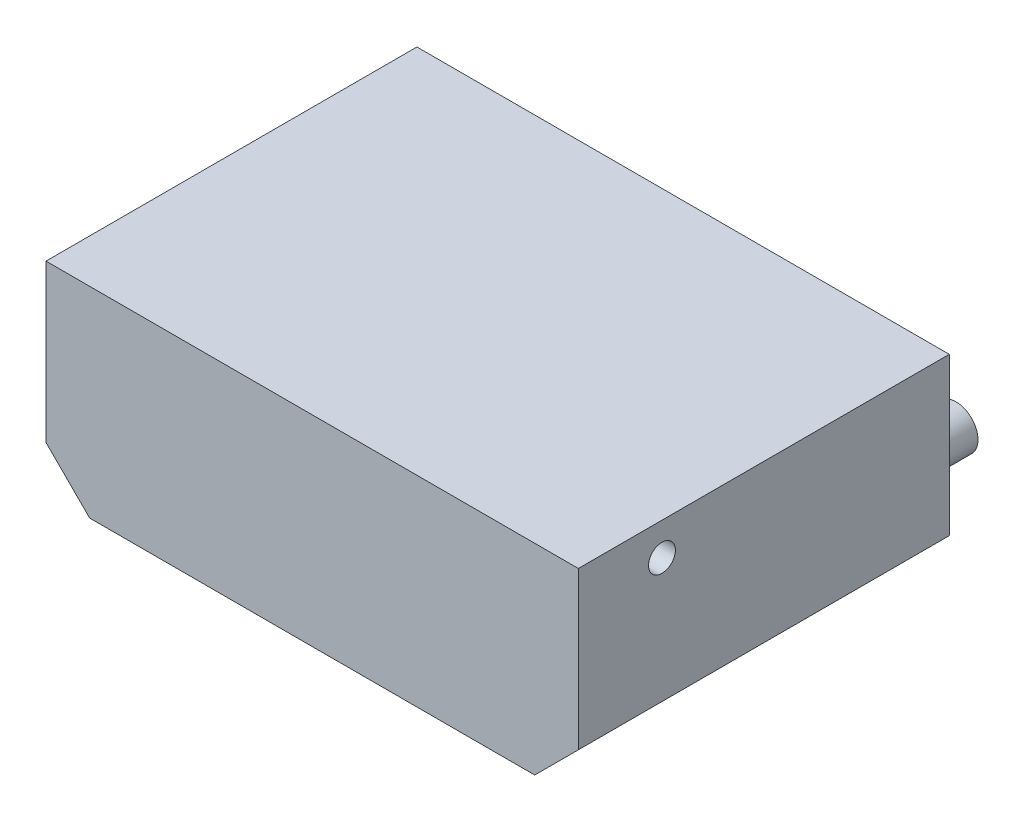
from build123d import *

# Parameters (mm, degrees)
BOSS_EXTRUDE1_DEPTH = 170
SKETCH2_W           = 174
SKETCH2_H           = 140
CUT_EXTRUDE1_DEPTH  = 0.1
SKETCH3_R           = 10
BOSS_EXTRUDE2_DEPTH = 18.7
CUT_EXTRUDE2_DEPTH  = 0.1
CUT_EXTRUDE3_REACH  = 302.919
SKETCH5_R           = 6.160372281


with BuildPart() as part:
    # Sketch1 → Boss-Extrude1 (new body)
    with BuildSketch(Plane.XY):
        Polygon((-102, -46), (-122, -26), (-122, 46), (122, 46), (122, -26), (102, -46), align=None)
    extrude(amount=BOSS_EXTRUDE1_DEPTH)

    # Sketch2 → Cut-Extrude1 (cut)
    with BuildSketch(Plane.XZ.offset(46)):
        with Locations((0, 85)):
            Rectangle(SKETCH2_W, SKETCH2_H)
    extrude(amount=-CUT_EXTRUDE1_DEPTH, mode=Mode.SUBTRACT)

    # Sketch3 → Boss-Extrude2 (add)
    with BuildSketch(Plane(origin=(0, 0, 0), x_dir=(-1, 0, 0), z_dir=(0, 0, -1))):
        with Locations(Location((-76.475491295, 0, 0), (0, 0, 180))):
            Circle(SKETCH3_R)
        with Locations(Location((-106.475491295, 0, 0), (0, 0, 180))):
            Circle(SKETCH3_R)
        with Locations(Location((-16.413091666, 0, 0), (0, 0, 180))):
            Circle(SKETCH3_R)
        with Locations(Location((13.586908334, 0, 0), (0, 0, 180))):
            Circle(SKETCH3_R)
    extrude(amount=BOSS_EXTRUDE2_DEPTH)

    # Sketch4 → Cut-Extrude2 (cut)
    # profile 1 of 8: a face of its own
    with BuildSketch(Plane.XZ.offset(45.9)):
        with BuildLine():
            Line((-42.268322494, 131.561403862), (-42.268322494, 131.083569118))
            add(Edge.make_bspline(
                [(-42.268322494, 131.083569118), (-42.422310774, 131.050224304), (-42.731367697, 130.983300734), (-43.16425574, 130.761058835), (-43.574269447, 130.460579751), (-43.808169871, 130.202231607), (-43.929544846, 130.068170287)],
                knots=[0, 0, 0, 0, 0.947408205, 1.901463304, 2.911033016, 4, 4, 4, 4], degree=3))
            add(Edge.make_bspline(
                [(-43.929544846, 130.068170287), (-43.977852767, 130.0066807), (-44.085689478, 129.869418846), (-44.238600073, 129.62465817), (-44.411442585, 129.328958663), (-44.596616217, 128.976318721), (-44.800647362, 128.569989633), (-45.025747476, 128.112451902), (-45.259781717, 127.5979898), (-45.420542284, 127.237357907), (-45.504906267, 127.048105382)],
                knots=[0, 0, 0, 0, 0.549484672, 1.226602557, 2.02645952, 2.958032851, 4.026270025, 5.223684279, 6.543044117, 8, 8, 8, 8], degree=3))
            Line((-45.504906267, 127.048105382), (-51.182926935, 114.120435709))
            Line((-51.182926935, 114.120435709), (-51.836216624, 114.120435709))
            Line((-51.836216624, 114.120435709), (-57.738222328, 127.746192078))
            add(Edge.make_bspline(
                [(-57.738222328, 127.746192078), (-57.822436758, 127.935515149), (-57.981782084, 128.29374053), (-58.213763464, 128.798753775), (-58.423274679, 129.242766517), (-58.606248109, 129.627353725), (-58.776129059, 129.945709462), (-58.920816078, 130.204004053), (-59.041781442, 130.402318114), (-59.176862593, 130.590301499), (-59.382327642, 130.761611506), (-59.687730804, 130.916067519), (-60.072261074, 131.022647616), (-60.355754594, 131.06226788), (-60.508170609, 131.083569118)],
                knots=[0, 0, 0, 0, 1.610291577, 3.046893938, 4.318728555, 5.425938633, 6.356009659, 7.122477988, 7.726240531, 8.161409343, 8.91557796, 9.776299492, 10.804460958, 12, 12, 12, 12], degree=3))
            Line((-60.508170609, 131.083569118), (-60.508170609, 131.561403862))
            Line((-60.508170609, 131.561403862), (-52.444709306, 131.561403862))
            Line((-52.444709306, 131.561403862), (-52.444709306, 131.083569118))
            Line((-52.444709306, 131.083569118), (-52.720957517, 131.083569118))
            add(Edge.make_bspline(
                [(-52.720957517, 131.083569118), (-52.891587215, 131.079806061), (-53.203789309, 131.072920774), (-53.628631285, 131.029736009), (-53.969575075, 130.947249337), (-54.152014222, 130.850286848), (-54.232856511, 130.807320907)],
                knots=[0, 0, 0, 0, 1.317031691, 2.409780111, 3.29534303, 4, 4, 4, 4], degree=3))
            add(Edge.make_bspline(
                [(-54.232856511, 130.807320907), (-54.277473498, 130.774801438), (-54.364247837, 130.711555228), (-54.454372234, 130.578245563), (-54.515609876, 130.42667613), (-54.521134191, 130.316468497), (-54.524037058, 130.258557568)],
                knots=[0, 0, 0, 0, 1.014177409, 1.972445466, 2.934578636, 4, 4, 4, 4], degree=3))
            add(Edge.make_bspline(
                [(-54.524037058, 130.258557568), (-54.51759972, 130.177346048), (-54.503328868, 129.997309277), (-54.446781809, 129.789988908), (-54.384882385, 129.622629018), (-54.337993199, 129.492058361), (-54.268189771, 129.329819645), (-54.192197776, 129.129992884), (-54.093307638, 128.898007031), (-53.977200191, 128.631704585), (-53.851295731, 128.326585327), (-53.759084016, 128.113138578), (-53.71022476, 128.000041786)],
                knots=[0, 0, 0, 0, 1.012231494, 2.244002945, 2.655403561, 3.233491586, 3.969557668, 4.852239662, 5.893194298, 7.106928332, 8.467078429, 10, 10, 10, 10], degree=3))
            Line((-53.71022476, 128.000041786), (-50.063001754, 119.589403676))
            Line((-50.063001754, 119.589403676), (-46.796553309, 127.021973795))
            add(Edge.make_bspline(
                [(-46.796553309, 127.021973795), (-46.743992783, 127.141303943), (-46.644010382, 127.368297763), (-46.505697534, 127.694785437), (-46.382886267, 127.988623442), (-46.27524101, 128.250174688), (-46.179403449, 128.477683514), (-46.106823388, 128.675577005), (-46.044908159, 128.838723117), (-45.97140133, 129.078848775), (-45.887522105, 129.382176018), (-45.870792644, 129.649509958), (-45.863282325, 129.769523572)],
                knots=[0, 0, 0, 0, 1.34070385, 2.550331934, 3.645759521, 4.615209621, 5.458693035, 6.183490299, 6.782524973, 7.251937004, 8.766318359, 10, 10, 10, 10], degree=3))
            add(Edge.make_bspline(
                [(-45.863282325, 129.769523572), (-45.865045448, 129.830699261), (-45.868499243, 129.950536727), (-45.907195817, 130.124551074), (-45.971097743, 130.287292593), (-46.061397271, 130.436868186), (-46.174919674, 130.572515024), (-46.31059618, 130.694054574), (-46.472716793, 130.795142895), (-46.592909722, 130.845101569), (-46.654696119, 130.870783334)],
                knots=[0, 0, 0, 0, 1.010725678, 1.979917312, 2.931899074, 3.892303657, 4.857111769, 5.848785412, 6.89414627, 8, 8, 8, 8], degree=3))
            add(Edge.make_bspline(
                [(-46.654696119, 130.870783334), (-46.751106707, 130.904210728), (-46.95670438, 130.975495372), (-47.296999425, 131.038418624), (-47.680496693, 131.074219371), (-47.949983983, 131.08034337), (-48.091933435, 131.083569118)],
                knots=[0, 0, 0, 0, 0.837444138, 1.785867817, 2.833730339, 4, 4, 4, 4], degree=3))
            Line((-48.091933435, 131.083569118), (-48.091933435, 131.561403862))
            Line((-48.091933435, 131.561403862), (-42.268322494, 131.561403862))
        make_face()
    # profile 2 of 8: a face of its own
    with BuildSketch(Plane.XZ.offset(45.9)):
        with BuildLine():
            Line((-32.715360699, 114.837187825), (-32.715360699, 114.359353081))
            Line((-32.715360699, 114.359353081), (-41.555303462, 114.359353081))
            Line((-41.555303462, 114.359353081), (-41.555303462, 114.837187825))
            Line((-41.555303462, 114.837187825), (-40.991607787, 114.837187825))
            add(Edge.make_bspline(
                [(-40.991607787, 114.837187825), (-40.874419273, 114.839376862), (-40.651358234, 114.843543557), (-40.334356413, 114.893064195), (-40.0513912, 114.97148981), (-39.884345139, 115.054896982), (-39.804487095, 115.094770616)],
                knots=[0, 0, 0, 0, 1.144467932, 2.17842344, 3.129177061, 4, 4, 4, 4], degree=3))
            add(Edge.make_bspline(
                [(-39.804487095, 115.094770616), (-39.752023379, 115.126419397), (-39.645901358, 115.190437596), (-39.50960772, 115.326045516), (-39.394109329, 115.491349899), (-39.334814502, 115.616409079), (-39.304253848, 115.680864794)],
                knots=[0, 0, 0, 0, 0.93343552, 1.888125192, 2.911536119, 4, 4, 4, 4], degree=3))
            add(Edge.make_bspline(
                [(-39.304253848, 115.680864794), (-39.292060648, 115.710433858), (-39.26428503, 115.777790994), (-39.243633861, 115.898582112), (-39.21368924, 116.045614439), (-39.198578397, 116.224528994), (-39.183334701, 116.43350563), (-39.171452541, 116.671255716), (-39.17020643, 116.938922919), (-39.167541573, 117.126816344), (-39.166129742, 117.226361544)],
                knots=[0, 0, 0, 0, 0.491154816, 1.118830903, 1.878082211, 2.802823963, 3.878617243, 5.106317376, 6.466938293, 8, 8, 8, 8], degree=3))
            Line((-39.166129742, 117.226361544), (-39.166129742, 128.694395398))
            add(Edge.make_bspline(
                [(-39.166129742, 128.694395398), (-39.167558231, 128.795184295), (-39.170291778, 128.988053327), (-39.171300965, 129.261950421), (-39.183430993, 129.505896596), (-39.198356347, 129.718670999), (-39.21464804, 129.903551704), (-39.242710616, 130.057222647), (-39.26499844, 130.183665593), (-39.311975145, 130.310280089), (-39.386792175, 130.448643644), (-39.513579615, 130.594480937), (-39.672755873, 130.729205177), (-39.864633066, 130.853435273), (-40.093485611, 130.959008057), (-40.36086046, 131.031082097), (-40.664034224, 131.076546195), (-40.878185904, 131.081137441), (-40.991607787, 131.083569118)],
                knots=[0, 0, 0, 0, 1.353963977, 2.590937397, 3.678525439, 4.633585292, 5.456840327, 6.168525469, 6.732370981, 7.176481794, 7.976852204, 8.830756602, 9.755347706, 10.770665926, 11.892520065, 13.125421506, 14.477527201, 16, 16, 16, 16], degree=3))
            Line((-40.991607787, 131.083569118), (-41.555303462, 131.083569118))
            Line((-41.555303462, 131.083569118), (-41.555303462, 131.561403862))
            Line((-41.555303462, 131.561403862), (-32.715360699, 131.561403862))
            Line((-32.715360699, 131.561403862), (-32.715360699, 131.083569118))
            Line((-32.715360699, 131.083569118), (-33.27532329, 131.083569118))
            add(Edge.make_bspline(
                [(-33.27532329, 131.083569118), (-33.392498481, 131.081334313), (-33.615534161, 131.077080502), (-33.931525083, 131.028331721), (-34.212805685, 130.948478265), (-34.378829809, 130.865777225), (-34.458710898, 130.825986326)],
                knots=[0, 0, 0, 0, 1.147815573, 2.184795468, 3.126629849, 4, 4, 4, 4], degree=3))
            add(Edge.make_bspline(
                [(-34.458710898, 130.825986326), (-34.511225686, 130.794376943), (-34.617451015, 130.730438437), (-34.753452299, 130.59368981), (-34.8729542, 130.429823584), (-34.934652862, 130.304433011), (-34.966410313, 130.239892148)],
                knots=[0, 0, 0, 0, 0.928829741, 1.878808762, 2.908183361, 4, 4, 4, 4], degree=3))
            add(Edge.make_bspline(
                [(-34.966410313, 130.239892148), (-34.978547501, 130.210312107), (-35.005733289, 130.144056504), (-35.028045639, 130.023624211), (-35.056402757, 129.876277657), (-35.072253665, 129.696258094), (-35.087141747, 129.488478888), (-35.099390735, 129.250755105), (-35.100386501, 128.983075694), (-35.10310411, 128.793939762), (-35.104534419, 128.694395398)],
                knots=[0, 0, 0, 0, 0.491143652, 1.100100526, 1.878201893, 2.802922625, 3.87869145, 5.087223688, 6.466973141, 8, 8, 8, 8], degree=3))
            Line((-35.104534419, 128.694395398), (-35.104534419, 117.226361544))
            add(Edge.make_bspline(
                [(-35.104534419, 117.226361544), (-35.103152709, 117.12556956), (-35.100508677, 116.932694619), (-35.09889698, 116.658837298), (-35.088670491, 116.414667302), (-35.067759125, 116.200949644), (-35.051125297, 116.016410063), (-35.029613026, 115.860206375), (-35.001284565, 115.735089338), (-34.956396916, 115.606611276), (-34.874104949, 115.472829235), (-34.75021689, 115.325953519), (-34.590258874, 115.191650501), (-34.39862173, 115.067291061), (-34.169694894, 114.961758317), (-33.902342641, 114.889672056), (-33.600395818, 114.844395966), (-33.387496682, 114.839675152), (-33.27532329, 114.837187825)],
                knots=[0, 0, 0, 0, 1.354319329, 2.591617395, 3.679490877, 4.636117144, 5.476222309, 6.168990776, 6.752950479, 7.19717785, 7.991448918, 8.845577426, 9.770411191, 10.785995884, 11.908144457, 13.141369476, 14.493830035, 16, 16, 16, 16], degree=3))
            Line((-33.27532329, 114.837187825), (-32.715360699, 114.837187825))
        make_face()
    # profile 3 of 8: a face of its own
    with BuildSketch(Plane.XZ.offset(45.9)):
        with BuildLine():
            Line((-31.759691211, 114.359353081), (-31.759691211, 114.837187825))
            Line((-31.759691211, 114.837187825), (-31.195995537, 114.837187825))
            add(Edge.make_bspline(
                [(-31.195995537, 114.837187825), (-31.080151575, 114.840045293), (-30.86257918, 114.845412047), (-30.556513148, 114.884747177), (-30.292527296, 114.954746527), (-30.066789049, 115.052566443), (-29.87652939, 115.177283927), (-29.719286986, 115.326905307), (-29.579649252, 115.490085591), (-29.514975778, 115.617102783), (-29.48251001, 115.680864794)],
                knots=[0, 0, 0, 0, 1.370884423, 2.574727263, 3.642922677, 4.592448042, 5.474721649, 6.318802883, 7.15604725, 8, 8, 8, 8], degree=3))
            add(Edge.make_bspline(
                [(-29.48251001, 115.680864794), (-29.47319392, 115.708074637), (-29.451532351, 115.771342371), (-29.431020412, 115.885618797), (-29.414235585, 116.030371421), (-29.393326406, 116.206766102), (-29.384466444, 116.416224816), (-29.378081699, 116.657675891), (-29.36825091, 116.931385686), (-29.369733364, 117.124314181), (-29.370517492, 117.226361544)],
                knots=[0, 0, 0, 0, 0.443546268, 1.031324162, 1.786729535, 2.694794477, 3.772216006, 5.021594906, 6.424606037, 8, 8, 8, 8], degree=3))
            Line((-29.370517492, 117.226361544), (-29.370517492, 128.694395398))
            add(Edge.make_bspline(
                [(-29.370517492, 128.694395398), (-29.37194598, 128.795184295), (-29.374679527, 128.988053327), (-29.375688715, 129.261950421), (-29.387818743, 129.505896596), (-29.402744097, 129.718670999), (-29.41903579, 129.903551704), (-29.447098366, 130.057222647), (-29.469386189, 130.183665593), (-29.516362895, 130.310280089), (-29.591179925, 130.448643644), (-29.717967364, 130.594480937), (-29.877143623, 130.729205177), (-30.069020815, 130.853435273), (-30.29787336, 130.959008057), (-30.565248209, 131.031082097), (-30.868421974, 131.076546195), (-31.082573653, 131.081137441), (-31.195995537, 131.083569118)],
                knots=[0, 0, 0, 0, 1.353963977, 2.590937397, 3.678525439, 4.633585292, 5.456840327, 6.168525469, 6.732370981, 7.176481794, 7.976852204, 8.830756602, 9.755347706, 10.770665926, 11.892520065, 13.125421506, 14.477527201, 16, 16, 16, 16], degree=3))
            Line((-31.195995537, 131.083569118), (-31.759691211, 131.083569118))
            Line((-31.759691211, 131.083569118), (-31.759691211, 131.561403862))
            Line((-31.759691211, 131.561403862), (-24.114335308, 131.561403862))
            add(Edge.make_bspline(
                [(-24.114335308, 131.561403862), (-23.865383885, 131.560124262), (-23.379559232, 131.557627144), (-22.67126664, 131.513037034), (-21.999250415, 131.453627421), (-21.365905459, 131.357617368), (-20.766306562, 131.246162335), (-20.206864378, 131.097375322), (-19.680210508, 130.934664691), (-19.351124788, 130.793929074), (-19.190397596, 130.72519306)],
                knots=[0, 0, 0, 0, 1.187623187, 2.317627336, 3.38521285, 4.405435058, 5.373093369, 6.293321195, 7.166449119, 8, 8, 8, 8], degree=3))
            add(Edge.make_bspline(
                [(-19.190397596, 130.72519306), (-19.004595225, 130.637486942), (-18.636513693, 130.463737802), (-18.119266561, 130.151400669), (-17.635501419, 129.810516103), (-17.183386127, 129.44028044), (-16.77024909, 129.031742645), (-16.387126388, 128.593512721), (-16.038483432, 128.122475013), (-15.730597701, 127.616933513), (-15.455019575, 127.089269228), (-15.217155889, 126.541988624), (-15.007319995, 125.980458122), (-14.847491788, 125.397153452), (-14.713158424, 124.799899151), (-14.627046854, 124.184267066), (-14.567646553, 123.55261676), (-14.561004194, 123.124777728), (-14.55764043, 122.908115296)],
                knots=[0, 0, 0, 0, 1.023059056, 2.026718722, 3.005407045, 3.969834614, 4.934282109, 5.896555333, 6.867417257, 7.849868272, 8.842554442, 9.830817097, 10.821274577, 11.826120625, 12.841487115, 13.869025607, 14.920850928, 16, 16, 16, 16], degree=3))
            add(Edge.make_bspline(
                [(-14.55764043, 122.908115296), (-14.564820927, 122.611608679), (-14.578959429, 122.027782845), (-14.690332455, 121.170883879), (-14.867186533, 120.347571096), (-15.122747714, 119.568686484), (-15.42829111, 118.839557875), (-15.787161272, 118.174599664), (-16.178919724, 117.569557077), (-16.624354129, 117.036311082), (-17.108018404, 116.564515165), (-17.618565384, 116.134474991), (-18.172130885, 115.762678566), (-18.759917593, 115.427420576), (-19.404309473, 115.143944025), (-20.10770071, 114.893658104), (-20.879734997, 114.682383422), (-21.419612803, 114.570378423), (-21.699030001, 114.512409522)],
                knots=[0, 0, 0, 0, 1.173207418, 2.310062444, 3.414262259, 4.501404309, 5.549709881, 6.539078478, 7.4884477, 8.39776528, 9.28236543, 10.160152656, 11.035781795, 11.917910606, 12.835037278, 13.817998386, 14.87069116, 16, 16, 16, 16], degree=3))
            add(Edge.make_bspline(
                [(-21.699030001, 114.512409522), (-21.844373357, 114.488127653), (-22.170908545, 114.433574867), (-22.721164441, 114.39020011), (-23.38117402, 114.366651718), (-23.85796762, 114.361905227), (-24.114335308, 114.359353081)],
                knots=[0, 0, 0, 0, 0.729469202, 1.638859668, 2.730435796, 4, 4, 4, 4], degree=3))
            Line((-24.114335308, 114.359353081), (-31.759691211, 114.359353081))
        make_face()
        with BuildLine():
            Line((-25.308922168, 130.605734374), (-25.308922168, 117.181564537))
            add(Edge.make_bspline(
                [(-25.308922168, 117.181564537), (-25.307605699, 117.021014182), (-25.305247175, 116.733379877), (-25.287206724, 116.353474614), (-25.26342519, 116.075531274), (-25.211529802, 115.844318532), (-25.079220237, 115.647408355), (-24.936921745, 115.553222475), (-24.86468518, 115.505409849)],
                knots=[0, 0, 0, 0, 1.581619866, 2.833554187, 3.746016832, 4.328809972, 5.15163522, 6, 6, 6, 6], degree=3))
            add(Edge.make_bspline(
                [(-24.86468518, 115.505409849), (-24.801998647, 115.475891329), (-24.667045353, 115.412343047), (-24.433912422, 115.358342607), (-24.165483299, 115.318810082), (-23.973917754, 115.316340508), (-23.871684853, 115.315022569)],
                knots=[0, 0, 0, 0, 0.812832084, 1.749887298, 2.799180973, 4, 4, 4, 4], degree=3))
            add(Edge.make_bspline(
                [(-23.871684853, 115.315022569), (-23.699764155, 115.319206319), (-23.364498403, 115.32736513), (-22.875891499, 115.394285076), (-22.420047206, 115.511356394), (-21.992844994, 115.665749894), (-21.60285145, 115.875174113), (-21.23991064, 116.122583457), (-20.908463916, 116.418005486), (-20.719349649, 116.647587066), (-20.623901827, 116.763459136)],
                knots=[0, 0, 0, 0, 1.117658457, 2.179566554, 3.198078308, 4.173511569, 5.125438597, 6.068069882, 7.024935961, 8, 8, 8, 8], degree=3))
            add(Edge.make_bspline(
                [(-20.623901827, 116.763459136), (-20.500027729, 116.934869725), (-20.245915298, 117.286497403), (-19.9396462, 117.88395974), (-19.679314856, 118.544875642), (-19.461974004, 119.271248082), (-19.301603461, 120.066463439), (-19.184042871, 120.926775562), (-19.106726207, 121.853983084), (-19.100360213, 122.494824014), (-19.097070497, 122.82598745)],
                knots=[0, 0, 0, 0, 0.797088956, 1.635129663, 2.524519068, 3.475303084, 4.491981832, 5.582369658, 6.750656001, 8, 8, 8, 8], degree=3))
            add(Edge.make_bspline(
                [(-19.097070497, 122.82598745), (-19.099501453, 123.094848376), (-19.104243803, 123.619346963), (-19.153725347, 124.385510737), (-19.234120376, 125.110930577), (-19.350720649, 125.794731112), (-19.493281556, 126.43790738), (-19.674590069, 127.038493572), (-19.882483799, 127.600117323), (-20.057109052, 127.949154628), (-20.142334, 128.119500472)],
                knots=[0, 0, 0, 0, 1.184457476, 2.310660313, 3.381113584, 4.398734162, 5.365689401, 6.281539716, 7.161314381, 8, 8, 8, 8], degree=3))
            add(Edge.make_bspline(
                [(-20.142334, 128.119500472), (-20.211872174, 128.243482252), (-20.348604395, 128.487266392), (-20.573096368, 128.831834391), (-20.824351786, 129.137299489), (-21.078814106, 129.420451703), (-21.355512701, 129.666817902), (-21.640085726, 129.889700125), (-21.946732047, 130.073362265), (-22.159829769, 130.174401968), (-22.26645876, 130.224959813)],
                knots=[0, 0, 0, 0, 1.119018596, 2.200315138, 3.231417848, 4.229706666, 5.193717379, 6.14394327, 7.071273713, 8, 8, 8, 8], degree=3))
            add(Edge.make_bspline(
                [(-22.26645876, 130.224959813), (-22.3492939, 130.257665654), (-22.5234614, 130.3264323), (-22.811869899, 130.402139849), (-23.135592406, 130.469785869), (-23.498757719, 130.519820775), (-23.898448113, 130.560482041), (-24.335408952, 130.590750873), (-24.809841736, 130.604312321), (-25.138438727, 130.605248608), (-25.308922168, 130.605734374)],
                knots=[0, 0, 0, 0, 0.692518899, 1.456076319, 2.316420686, 3.265494417, 4.307135134, 5.442799475, 6.673267388, 8, 8, 8, 8], degree=3))
        make_face(mode=Mode.SUBTRACT)
    # profile 4 of 8: a face of its own
    with BuildSketch(Plane.XZ.offset(45.9)):
        with BuildLine():
            Line((-6.434449783, 130.366817002), (-6.434449783, 123.677130587))
            Line((-6.434449783, 123.677130587), (-6.098472229, 123.677130587))
            add(Edge.make_bspline(
                [(-6.098472229, 123.677130587), (-5.968899056, 123.679496754), (-5.718717385, 123.684065381), (-5.35699716, 123.733247016), (-5.023105412, 123.81548565), (-4.715757446, 123.926778253), (-4.433862328, 124.069110137), (-4.183693263, 124.249622122), (-3.961140454, 124.461367503), (-3.764385303, 124.703705381), (-3.594480631, 124.979679253), (-3.436403292, 125.283806612), (-3.296416844, 125.618681733), (-3.171539245, 125.983771759), (-3.070674404, 126.380542573), (-2.975376063, 126.805559799), (-2.901065582, 127.261805475), (-2.86779656, 127.576768103), (-2.850689204, 127.738725911)],
                knots=[0, 0, 0, 0, 1.062093487, 2.05070476, 2.986276895, 3.877322359, 4.726232003, 5.567315723, 6.39743211, 7.238949076, 8.11947221, 9.050581245, 10.047531836, 11.093122518, 12.211943632, 13.402946799, 14.664562062, 16, 16, 16, 16], degree=3))
            Line((-2.850689204, 127.738725911), (-2.37285446, 127.738725911))
            Line((-2.37285446, 127.738725911), (-2.37285446, 118.659865776))
            Line((-2.37285446, 118.659865776), (-2.850689204, 118.659865776))
            add(Edge.make_bspline(
                [(-2.850689204, 118.659865776), (-2.87989522, 118.897990324), (-2.936022973, 119.35561506), (-3.066648075, 120.005326337), (-3.246677607, 120.586590556), (-3.465376893, 121.098087993), (-3.713226383, 121.536902013), (-3.979167752, 121.905218204), (-4.269502815, 122.192743713), (-4.593069699, 122.407021219), (-4.961768657, 122.553976158), (-5.39124164, 122.650286985), (-5.888725663, 122.71480052), (-6.245070213, 122.719149716), (-6.434449783, 122.721461099)],
                knots=[0, 0, 0, 0, 1.403482868, 2.697195568, 3.871661546, 4.957716503, 5.945698591, 6.815061024, 7.607980598, 8.3228477, 9.070553376, 9.91645821, 10.892700197, 12, 12, 12, 12], degree=3))
            Line((-6.434449783, 122.721461099), (-6.434449783, 117.808722638))
            add(Edge.make_bspline(
                [(-6.434449783, 117.808722638), (-6.435299715, 117.694228822), (-6.436907421, 117.477655819), (-6.426238047, 117.170392013), (-6.422501051, 116.897614183), (-6.405307411, 116.660102878), (-6.391428352, 116.457128551), (-6.375158554, 116.288350656), (-6.348463993, 116.155402298), (-6.315524962, 116.023943542), (-6.252488656, 115.889605388), (-6.148075197, 115.753266889), (-6.029545081, 115.621395477), (-5.874419551, 115.511829463), (-5.68277549, 115.419066647), (-5.442920437, 115.360531114), (-5.158024987, 115.317750583), (-4.95138179, 115.31597564), (-4.840422942, 115.315022569)],
                knots=[0, 0, 0, 0, 1.552990816, 2.937589936, 4.170316776, 5.252766198, 6.166801655, 6.931091326, 7.550164809, 8.004681738, 8.767478654, 9.540664334, 10.328815109, 11.162812995, 12.099025042, 13.200523488, 14.496796931, 16, 16, 16, 16], degree=3))
            Line((-4.840422942, 115.315022569), (-3.839956447, 115.315022569))
            add(Edge.make_bspline(
                [(-3.839956447, 115.315022569), (-3.649477863, 115.319142224), (-3.276613649, 115.327206502), (-2.731207931, 115.374483441), (-2.214023238, 115.45907396), (-1.728306135, 115.584288703), (-1.269343718, 115.734844059), (-0.842415531, 115.926596095), (-0.444277528, 116.15226126), (-0.071830687, 116.409312646), (0.269655703, 116.708598792), (0.58727955, 117.040735676), (0.879522601, 117.410193399), (1.149943494, 117.812926025), (1.387338251, 118.257594797), (1.603839619, 118.734889204), (1.795093089, 119.249121), (1.900010679, 119.60736159), (1.953789823, 119.790990209)],
                knots=[0, 0, 0, 0, 1.142897584, 2.237236343, 3.281746819, 4.283100764, 5.244004367, 6.176409463, 7.085783423, 7.986720822, 8.886419989, 9.805245571, 10.740366748, 11.709443732, 12.71166011, 13.76082962, 14.852235686, 16, 16, 16, 16], degree=3))
            Line((1.953789823, 119.790990209), (2.405492979, 119.790990209))
            Line((2.405492979, 119.790990209), (1.64767694, 114.359353081))
            Line((1.64767694, 114.359353081), (-12.885218826, 114.359353081))
            Line((-12.885218826, 114.359353081), (-12.885218826, 114.837187825))
            Line((-12.885218826, 114.837187825), (-12.321523152, 114.837187825))
            add(Edge.make_bspline(
                [(-12.321523152, 114.837187825), (-12.204334638, 114.839376862), (-11.981273598, 114.843543557), (-11.664271778, 114.893064195), (-11.381306564, 114.97148981), (-11.214260504, 115.054896982), (-11.13440246, 115.094770616)],
                knots=[0, 0, 0, 0, 1.144467932, 2.17842344, 3.129177061, 4, 4, 4, 4], degree=3))
            add(Edge.make_bspline(
                [(-11.13440246, 115.094770616), (-11.081938744, 115.126419397), (-10.975816722, 115.190437596), (-10.839523085, 115.326045516), (-10.724024693, 115.491349899), (-10.664729867, 115.616409079), (-10.634169212, 115.680864794)],
                knots=[0, 0, 0, 0, 0.93343552, 1.888125192, 2.911536119, 4, 4, 4, 4], degree=3))
            add(Edge.make_bspline(
                [(-10.634169212, 115.680864794), (-10.621976013, 115.710433858), (-10.594200395, 115.777790994), (-10.573549225, 115.898582112), (-10.543604604, 116.045614439), (-10.528493762, 116.224528994), (-10.513250065, 116.43350563), (-10.501367906, 116.671255716), (-10.500121794, 116.938922919), (-10.497456937, 117.126816344), (-10.496045107, 117.226361544)],
                knots=[0, 0, 0, 0, 0.491154816, 1.118830903, 1.878082211, 2.802823963, 3.878617243, 5.106317376, 6.466938293, 8, 8, 8, 8], degree=3))
            Line((-10.496045107, 117.226361544), (-10.496045107, 128.694395398))
            add(Edge.make_bspline(
                [(-10.496045107, 128.694395398), (-10.496712658, 128.863640663), (-10.497910513, 129.167334786), (-10.506850201, 129.568225493), (-10.525806979, 129.86135406), (-10.550095268, 130.018479751), (-10.559507534, 130.079369539)],
                knots=[0, 0, 0, 0, 1.46329711, 2.625743972, 3.467444458, 4, 4, 4, 4], degree=3))
            add(Edge.make_bspline(
                [(-10.559507534, 130.079369539), (-10.58226316, 130.147449406), (-10.626781734, 130.280639265), (-10.728789968, 130.462548054), (-10.860600194, 130.619046549), (-10.968430173, 130.699733465), (-11.022409942, 130.740125396)],
                knots=[0, 0, 0, 0, 1.044138947, 2.04272901, 3.020188662, 4, 4, 4, 4], degree=3))
            add(Edge.make_bspline(
                [(-11.022409942, 130.740125396), (-11.106571478, 130.793270645), (-11.281520398, 130.903745148), (-11.590824829, 131.008602457), (-11.941855443, 131.071636529), (-12.190554659, 131.079452905), (-12.321523152, 131.083569118)],
                knots=[0, 0, 0, 0, 0.872834083, 1.81438441, 2.849024194, 4, 4, 4, 4], degree=3))
            Line((-12.321523152, 131.083569118), (-12.885218826, 131.083569118))
            Line((-12.885218826, 131.083569118), (-12.885218826, 131.561403862))
            Line((-12.885218826, 131.561403862), (1.21090612, 131.561403862))
            Line((1.21090612, 131.561403862), (1.21090612, 126.305221679))
            Line((1.21090612, 126.305221679), (0.733071376, 126.305221679))
            add(Edge.make_bspline(
                [(0.733071376, 126.305221679), (0.703163859, 126.453562698), (0.645100176, 126.741558053), (0.541094548, 127.155305667), (0.425228486, 127.536113116), (0.302539307, 127.88389906), (0.172449608, 128.200226377), (0.030814078, 128.483005431), (-0.117116784, 128.73607153), (-0.333726288, 129.025804387), (-0.641381544, 129.345729583), (-1.075903275, 129.671889471), (-1.57932392, 129.940996445), (-1.947783531, 130.071726698), (-2.137670172, 130.139098882)],
                knots=[0, 0, 0, 0, 1.069557103, 2.076482136, 3.014180904, 3.882168483, 4.682592328, 5.429982227, 6.116341669, 6.751412971, 7.983148368, 9.239203021, 10.577215927, 12, 12, 12, 12], degree=3))
            add(Edge.make_bspline(
                [(-2.137670172, 130.139098882), (-2.2022074, 130.157157378), (-2.342662827, 130.196458938), (-2.575344473, 130.245716727), (-2.847867628, 130.278842764), (-3.157320785, 130.315387416), (-3.505147305, 130.333889149), (-3.88953004, 130.354251228), (-4.312758419, 130.364791568), (-4.60772382, 130.366121355), (-4.76202818, 130.366817002)],
                knots=[0, 0, 0, 0, 0.608728222, 1.324804056, 2.157687748, 3.10140268, 4.154841575, 5.320503916, 6.598283308, 8, 8, 8, 8], degree=3))
            Line((-4.76202818, 130.366817002), (-6.434449783, 130.366817002))
        make_face()
    # profile 5 of 8: a face of its own
    with BuildSketch(Plane.XZ.offset(45.9)):
        with BuildLine():
            add(Edge.make_bspline(
                [(13.522616943, 131.800321234), (13.855046745, 131.805504483), (14.50512698, 131.815640542), (15.458774133, 131.722028973), (16.365327198, 131.552203177), (17.225293419, 131.299870136), (18.033859019, 130.955945454), (18.797205793, 130.532305993), (19.51228081, 130.022787899), (20.170401443, 129.432969396), (20.763254221, 128.783237139), (21.286671577, 128.089506112), (21.729399361, 127.355576978), (22.089508415, 126.580475254), (22.371880541, 125.76658668), (22.566931818, 124.911469773), (22.69038344, 124.017947748), (22.705679389, 123.408760711), (22.713469596, 123.098502577)],
                knots=[0, 0, 0, 0, 1.117599178, 2.185511443, 3.216596641, 4.216496892, 5.193720437, 6.166199278, 7.147635958, 8.140749636, 9.133263309, 10.101842832, 11.059452728, 12.010747998, 12.971773146, 13.951566087, 14.956735376, 16, 16, 16, 16], degree=3))
            add(Edge.make_bspline(
                [(22.713469596, 123.098502577), (22.707885412, 122.831957648), (22.696867316, 122.306040585), (22.604699609, 121.529403425), (22.454530333, 120.777222872), (22.251294839, 120.046386223), (21.980834273, 119.342229499), (21.648671135, 118.665159301), (21.267441918, 118.006059271), (20.963052797, 117.596895019), (20.809596788, 117.390617237)],
                knots=[0, 0, 0, 0, 1.043246653, 2.058419255, 3.056808262, 4.043829632, 5.024555343, 6.005002729, 6.994233708, 8, 8, 8, 8], degree=3))
            add(Edge.make_bspline(
                [(20.809596788, 117.390617237), (20.70295386, 117.257329972), (20.491738158, 116.993342817), (20.148801277, 116.624415114), (19.796705136, 116.274483209), (19.420056985, 115.958436371), (19.032783891, 115.662310753), (18.628042642, 115.392078777), (18.205932554, 115.150116944), (17.768504019, 114.932777337), (17.314026732, 114.742728196), (16.845360103, 114.573077864), (16.356622307, 114.436783709), (15.853703563, 114.32028049), (15.333930529, 114.230675105), (14.799180893, 114.169313353), (14.248836824, 114.124481896), (13.87611036, 114.121798235), (13.686872637, 114.120435709)],
                knots=[0, 0, 0, 0, 1.00627325, 1.9930127, 2.968556301, 3.931628562, 4.889992766, 5.842467438, 6.799060146, 7.757311971, 8.720859362, 9.702647782, 10.694476427, 11.710892394, 12.745970349, 13.802697082, 14.884402792, 16, 16, 16, 16], degree=3))
            add(Edge.make_bspline(
                [(13.686872637, 114.120435709), (13.497657841, 114.122168565), (13.123823467, 114.125592192), (12.570912668, 114.165389182), (12.033689331, 114.223096582), (11.51258686, 114.30872309), (11.009253851, 114.42344258), (10.51847165, 114.549772133), (10.048578852, 114.712627391), (9.594337812, 114.896979513), (9.153850358, 115.100231541), (8.731002899, 115.332201597), (8.327387037, 115.591497195), (7.938677457, 115.871986915), (7.563760735, 116.17360723), (7.208736305, 116.504479438), (6.868507823, 116.858565957), (6.656114998, 117.110673328), (6.549216149, 117.237560796)],
                knots=[0, 0, 0, 0, 1.12499151, 2.222661784, 3.294793131, 4.33735381, 5.360698186, 6.364076506, 7.349253377, 8.315262806, 9.278632822, 10.232406028, 11.180767221, 12.129590213, 13.081869556, 14.040110377, 15.013573345, 16, 16, 16, 16], degree=3))
            add(Edge.make_bspline(
                [(6.549216149, 117.237560796), (6.389937944, 117.445214182), (6.07315046, 117.858214779), (5.666873313, 118.520773598), (5.325387769, 119.21259416), (5.044700257, 119.932117925), (4.823615408, 120.679957228), (4.667438287, 121.45689035), (4.571423653, 122.262349985), (4.561026882, 122.809541031), (4.555749327, 123.087303325)],
                knots=[0, 0, 0, 0, 0.995754374, 1.980450006, 2.952842694, 3.929288476, 4.917067138, 5.917621276, 6.942953664, 8, 8, 8, 8], degree=3))
            add(Edge.make_bspline(
                [(4.555749327, 123.087303325), (4.563745848, 123.397515454), (4.579446894, 124.006612158), (4.700046614, 124.901356942), (4.906119389, 125.755026725), (5.19145688, 126.570363686), (5.554004981, 127.347415496), (6.001324899, 128.083073552), (6.532293107, 128.777151838), (7.137162871, 129.424946233), (7.798474156, 130.013817181), (8.504242968, 130.527928708), (9.251081391, 130.949741869), (10.033415098, 131.293256111), (10.853263624, 131.551483967), (11.711832873, 131.721692691), (12.605928882, 131.815380483), (13.213816855, 131.805394167), (13.522616943, 131.800321234)],
                knots=[0, 0, 0, 0, 1.060255294, 2.081794832, 3.079505486, 4.0575798, 5.030022739, 6.005429218, 6.99491703, 8.012249652, 9.030720031, 10.017772549, 10.991257006, 11.957043232, 12.933793802, 13.923226749, 14.945023109, 16, 16, 16, 16], degree=3))
        make_face()
        with BuildLine():
            add(Edge.make_bspline(
                [(13.671940301, 130.844651746), (13.480921039, 130.838023845), (13.107869311, 130.825079862), (12.567741284, 130.707717385), (12.06139104, 130.526519967), (11.592459278, 130.262250079), (11.156014426, 129.929371585), (10.762411476, 129.514015953), (10.401468035, 129.030028544), (10.199785724, 128.668359519), (10.095645889, 128.481609614)],
                knots=[0, 0, 0, 0, 1.010341478, 1.973149883, 2.913323355, 3.848402755, 4.811842333, 5.809142135, 6.868737798, 8, 8, 8, 8], degree=3))
            add(Edge.make_bspline(
                [(10.095645889, 128.481609614), (10.01389129, 128.312549616), (9.844680671, 127.962639677), (9.649477476, 127.392469947), (9.476305037, 126.773269679), (9.335508116, 126.101122186), (9.229245133, 125.375366722), (9.152171071, 124.598042978), (9.102054656, 123.768626715), (9.097516207, 123.198127703), (9.095179394, 122.904382212)],
                knots=[0, 0, 0, 0, 0.787943638, 1.630837067, 2.525905988, 3.487208031, 4.51219802, 5.604605297, 6.766629954, 8, 8, 8, 8], degree=3))
            add(Edge.make_bspline(
                [(9.095179394, 122.904382212), (9.098426009, 122.55579756), (9.104707107, 121.881404424), (9.182544143, 120.905844547), (9.298199534, 120.000184966), (9.464885934, 119.165111602), (9.680507003, 118.399183525), (9.943888821, 117.703443798), (10.255196844, 117.074588496), (10.511836108, 116.702294972), (10.63694306, 116.52080868)],
                knots=[0, 0, 0, 0, 1.253361503, 2.424829634, 3.517270749, 4.535371114, 5.484506921, 6.375489106, 7.20808062, 8, 8, 8, 8], degree=3))
            add(Edge.make_bspline(
                [(10.63694306, 116.52080868), (10.728798175, 116.405132847), (10.908332711, 116.179039752), (11.220998032, 115.884963309), (11.556614199, 115.630921496), (11.926518735, 115.431954613), (12.316402363, 115.26710611), (12.73622536, 115.156885085), (13.181857912, 115.088117532), (13.488755879, 115.080171514), (13.645808713, 115.076105197)],
                knots=[0, 0, 0, 0, 1.020058884, 1.99374635, 2.959073536, 3.921751619, 4.889988268, 5.879249688, 6.914721236, 8, 8, 8, 8], degree=3))
            add(Edge.make_bspline(
                [(13.645808713, 115.076105197), (13.854368688, 115.08186431), (14.257789997, 115.093004266), (14.833915194, 115.218694743), (15.363763617, 115.405826699), (15.670967689, 115.602642612), (15.822196649, 115.699530214)],
                knots=[0, 0, 0, 0, 1.086516288, 2.101667992, 3.065498145, 4, 4, 4, 4], degree=3))
            add(Edge.make_bspline(
                [(15.822196649, 115.699530214), (15.91299245, 115.768982675), (16.097513785, 115.910128638), (16.356071695, 116.153146856), (16.59293486, 116.431621911), (16.818852351, 116.735099793), (17.027256958, 117.068982938), (17.222524627, 117.431023254), (17.395502391, 117.826072672), (17.562505822, 118.24785498), (17.705619313, 118.703709402), (17.835132086, 119.191341866), (17.935019195, 119.713553617), (18.027783466, 120.266836385), (18.092059823, 120.853975585), (18.14200748, 121.473850629), (18.165818683, 122.127719115), (18.171254426, 122.574614113), (18.174039529, 122.803588946)],
                knots=[0, 0, 0, 0, 0.707878774, 1.438598863, 2.192768746, 2.969795667, 3.780358143, 4.628744544, 5.515519471, 6.450279976, 7.437595481, 8.473401936, 9.573958948, 10.729714514, 11.947871327, 13.231394215, 14.581454142, 16, 16, 16, 16], degree=3))
            add(Edge.make_bspline(
                [(18.174039529, 122.803588946), (18.171752655, 123.073644461), (18.167324992, 123.596504497), (18.137304576, 124.35463243), (18.089548139, 125.060574335), (18.023855954, 125.714608224), (17.936653387, 126.315634981), (17.821778837, 126.862705091), (17.700232195, 127.359751734), (17.547929793, 127.804867231), (17.380334558, 128.206163607), (17.21141122, 128.579015622), (17.022530011, 128.916934828), (16.831625538, 129.230344492), (16.619883802, 129.5053993), (16.404010785, 129.756066937), (16.171920642, 129.971512511), (15.853686833, 130.220329135), (15.427942743, 130.474642096), (14.874445244, 130.686893772), (14.28590588, 130.82458051), (13.87929012, 130.837873244), (13.671940301, 130.844651746)],
                knots=[0, 0, 0, 0, 1.564715362, 3.029477591, 4.395383686, 5.663787164, 6.837420581, 7.912070591, 8.901835802, 9.800165859, 10.634314221, 11.421391877, 12.170015688, 12.876189058, 13.5452815, 14.178775877, 14.79090283, 15.376466922, 16.517763855, 17.647800425, 18.800518316, 20, 20, 20, 20], degree=3))
        make_face(mode=Mode.SUBTRACT)
    # profile 6 of 8: a face of its own
    with BuildSketch(Plane.XZ.offset(45.9)):
        with BuildLine():
            Line((27.491817035, 131.083569118), (27.491817035, 131.561403862))
            Line((27.491817035, 131.561403862), (36.57067717, 131.561403862))
            Line((36.57067717, 131.561403862), (36.57067717, 131.083569118))
            Line((36.57067717, 131.083569118), (36.021913831, 131.083569118))
            add(Edge.make_bspline(
                [(36.021913831, 131.083569118), (35.903509535, 131.081240643), (35.676796453, 131.076782227), (35.355740346, 131.028766776), (35.069622942, 130.948435011), (34.901002571, 130.865766986), (34.819860803, 130.825986326)],
                knots=[0, 0, 0, 0, 1.143114955, 2.188764464, 3.128415797, 4, 4, 4, 4], degree=3))
            add(Edge.make_bspline(
                [(34.819860803, 130.825986326), (34.768519229, 130.794391416), (34.664519276, 130.730391253), (34.532666127, 130.5923966), (34.412915437, 130.429983345), (34.351327839, 130.3044873), (34.319627556, 130.239892148)],
                knots=[0, 0, 0, 0, 0.919805455, 1.863201995, 2.900150267, 4, 4, 4, 4], degree=3))
            add(Edge.make_bspline(
                [(34.319627556, 130.239892148), (34.307490368, 130.210312107), (34.28030458, 130.144056504), (34.25799223, 130.023624211), (34.229635112, 129.876277657), (34.213784204, 129.696258094), (34.198896122, 129.488478888), (34.186647134, 129.250755105), (34.185651368, 128.983075694), (34.182933759, 128.793939762), (34.18150345, 128.694395398)],
                knots=[0, 0, 0, 0, 0.491143652, 1.100100526, 1.878201893, 2.802922625, 3.87869145, 5.087223688, 6.466973141, 8, 8, 8, 8], degree=3))
            Line((34.18150345, 128.694395398), (34.18150345, 120.317355044))
            add(Edge.make_bspline(
                [(34.18150345, 120.317355044), (34.180073274, 120.119485569), (34.177310877, 119.737298992), (34.156163217, 119.18434559), (34.115081539, 118.67385066), (34.059388067, 118.204304334), (33.990057119, 117.776678626), (33.905073719, 117.391219292), (33.805017507, 117.047314127), (33.684969933, 116.741111988), (33.542525357, 116.462639494), (33.38212486, 116.199121112), (33.193951422, 115.949655009), (32.984324883, 115.708852028), (32.747882174, 115.48083001), (32.486076586, 115.265053309), (32.201454469, 115.059902978), (31.896521093, 114.864775111), (31.569037786, 114.691233123), (31.22569361, 114.536476461), (30.863625435, 114.411089087), (30.488127792, 114.301461895), (30.093751746, 114.218863698), (29.682910567, 114.166337767), (29.25713557, 114.125234447), (28.967735787, 114.122051718), (28.820794917, 114.120435709)],
                knots=[0, 0, 0, 0, 1.505497279, 2.907880824, 4.209142007, 5.40110598, 6.504661788, 7.503861046, 8.402553078, 9.227120721, 10.00197684, 10.779777326, 11.571286615, 12.376438297, 13.206693614, 14.067377457, 14.955585101, 15.874887265, 16.819438452, 17.773056631, 18.737284655, 19.732168474, 20.747872773, 21.798967748, 22.882440089, 24, 24, 24, 24], degree=3))
            add(Edge.make_bspline(
                [(28.820794917, 114.120435709), (28.64147226, 114.124076806), (28.291996876, 114.131172809), (27.780472984, 114.184834722), (27.295022353, 114.26997064), (26.834172563, 114.387175719), (26.401843768, 114.546931295), (25.994490049, 114.735442016), (25.613165835, 114.962073762), (25.263602694, 115.220609688), (24.948450774, 115.499928702), (24.668329228, 115.786259054), (24.437604055, 116.086554602), (24.244266013, 116.390418922), (24.092301759, 116.701480297), (23.98810381, 117.0220645), (23.921549132, 117.349307636), (23.91256339, 117.570736713), (23.908056456, 117.681797785)],
                knots=[0, 0, 0, 0, 1.284531702, 2.50337698, 3.680324039, 4.81336938, 5.904827366, 6.977667383, 8.024979121, 9.07698531, 10.087568935, 11.039637744, 11.941947136, 12.795274823, 13.616663969, 14.414493008, 15.204765209, 16, 16, 16, 16], degree=3))
            add(Edge.make_bspline(
                [(23.908056456, 117.681797785), (23.914273215, 117.81929016), (23.926255528, 118.084295873), (24.024991633, 118.461883399), (24.1916179, 118.798581767), (24.425653852, 119.085043618), (24.703728421, 119.320996935), (25.019029948, 119.49152366), (25.363458363, 119.597791941), (25.603348787, 119.60953032), (25.726068333, 119.615535264)],
                knots=[0, 0, 0, 0, 1.111024597, 2.141412317, 3.13183341, 4.127000835, 5.113012515, 6.063438972, 7.009323149, 8, 8, 8, 8], degree=3))
            add(Edge.make_bspline(
                [(25.726068333, 119.615535264), (25.84609897, 119.610118645), (26.079782315, 119.599573224), (26.415853246, 119.507634578), (26.719759455, 119.351116128), (26.987056719, 119.137912493), (27.210338939, 118.883368175), (27.376813247, 118.59378675), (27.471640868, 118.272427452), (27.484997112, 118.049485446), (27.491817035, 117.935647492)],
                knots=[0, 0, 0, 0, 1.059886431, 2.063454898, 3.052504102, 4.062864683, 5.068902847, 6.029641509, 6.993901676, 8, 8, 8, 8], degree=3))
            add(Edge.make_bspline(
                [(27.491817035, 117.935647492), (27.489506237, 117.826892106), (27.48514126, 117.621458801), (27.438911369, 117.421334354), (27.417155357, 117.327154811)],
                knots=[0, 0, 0, 0, 1.058790212, 2, 2, 2, 2], degree=3))
            add(Edge.make_bspline(
                [(27.417155357, 117.327154811), (27.405221061, 117.298285698), (27.374336161, 117.223574992), (27.297775185, 117.093772971), (27.201358246, 116.910274894), (27.071222654, 116.699686578), (26.949530634, 116.481520769), (26.852478552, 116.285085354), (26.791460895, 116.123599361), (26.779897517, 116.024613166), (26.775064919, 115.983244593)],
                knots=[0, 0, 0, 0, 0.499957875, 1.293846689, 2.409117305, 3.821102495, 5.257779245, 6.407957066, 7.334649195, 8, 8, 8, 8], degree=3))
            add(Edge.make_bspline(
                [(26.775064919, 115.983244593), (26.779012601, 115.930043085), (26.786872717, 115.824115093), (26.864240303, 115.676607253), (26.971443161, 115.534943254), (27.072563078, 115.461876173), (27.125974809, 115.423282003)],
                knots=[0, 0, 0, 0, 0.921734977, 1.835240012, 2.856569691, 4, 4, 4, 4], degree=3))
            add(Edge.make_bspline(
                [(27.125974809, 115.423282003), (27.216339655, 115.368671939), (27.402636415, 115.256087472), (27.726044647, 115.152333835), (28.084019208, 115.088286476), (28.335178579, 115.080280246), (28.466151943, 115.076105197)],
                knots=[0, 0, 0, 0, 0.899773797, 1.854979576, 2.881425205, 4, 4, 4, 4], degree=3))
            add(Edge.make_bspline(
                [(28.466151943, 115.076105197), (28.559739905, 115.079659457), (28.739768768, 115.086496549), (28.996765117, 115.139380283), (29.227718195, 115.22544729), (29.435517827, 115.345899857), (29.612318224, 115.5106965), (29.763508961, 115.711102374), (29.883672194, 115.951492865), (29.957961971, 116.186554038), (30.007736606, 116.422196595), (30.032376701, 116.669977303), (30.064679312, 116.981887744), (30.085016497, 117.359321268), (30.09886149, 117.801178428), (30.109916794, 118.30891572), (30.117196748, 118.882586485), (30.118973377, 119.287021435), (30.119908127, 119.499809662)],
                knots=[0, 0, 0, 0, 0.840258966, 1.616349614, 2.345107717, 3.046784395, 3.7588909, 4.501155896, 5.291051532, 6.160689297, 6.708784704, 7.451975061, 8.395229653, 9.52626267, 10.846099728, 12.366764469, 14.088420045, 16, 16, 16, 16], degree=3))
            Line((30.119908127, 119.499809662), (30.119908127, 128.694395398))
            add(Edge.make_bspline(
                [(30.119908127, 128.694395398), (30.118294307, 128.795171955), (30.115206111, 128.988017374), (30.116584331, 129.262140353), (30.096882978, 129.505649686), (30.086720339, 129.719181551), (30.060009998, 129.902560691), (30.044120535, 130.059007527), (30.007804088, 130.182558222), (29.964093722, 130.311323155), (29.883235292, 130.448497456), (29.753548578, 130.595802274), (29.586538466, 130.728990244), (29.387582081, 130.85346819), (29.151234847, 130.958912684), (28.875376537, 131.031477802), (28.563431342, 131.076231288), (28.343127743, 131.081039634), (28.227234571, 131.083569118)],
                knots=[0, 0, 0, 0, 1.335050966, 2.554745571, 3.628027627, 4.56974661, 5.38334016, 6.08256361, 6.646295578, 7.084202775, 7.881440169, 8.734155199, 9.671103026, 10.700068138, 11.836291303, 13.083729802, 14.465863454, 16, 16, 16, 16], degree=3))
            Line((28.227234571, 131.083569118), (27.491817035, 131.083569118))
        make_face()
    # profile 7 of 8: a face of its own
    with BuildSketch(Plane.XZ.offset(45.9)):
        with BuildLine():
            Line((43.738198329, 130.366817002), (43.738198329, 123.677130587))
            Line((43.738198329, 123.677130587), (44.074175883, 123.677130587))
            add(Edge.make_bspline(
                [(44.074175883, 123.677130587), (44.203749056, 123.679496754), (44.453930727, 123.684065381), (44.815650952, 123.733247016), (45.1495427, 123.81548565), (45.456890666, 123.926778253), (45.738785784, 124.069110137), (45.988954849, 124.249622122), (46.211507658, 124.461367503), (46.408262809, 124.703705381), (46.578167481, 124.979679253), (46.73624482, 125.283806612), (46.876231268, 125.618681733), (47.001108867, 125.983771759), (47.101973708, 126.380542573), (47.197272049, 126.805559799), (47.27158253, 127.261805475), (47.304851552, 127.576768103), (47.321958908, 127.738725911)],
                knots=[0, 0, 0, 0, 1.062093487, 2.05070476, 2.986276895, 3.877322359, 4.726232003, 5.567315723, 6.39743211, 7.238949076, 8.11947221, 9.050581245, 10.047531836, 11.093122518, 12.211943632, 13.402946799, 14.664562062, 16, 16, 16, 16], degree=3))
            Line((47.321958908, 127.738725911), (47.799793652, 127.738725911))
            Line((47.799793652, 127.738725911), (47.799793652, 118.659865776))
            Line((47.799793652, 118.659865776), (47.321958908, 118.659865776))
            add(Edge.make_bspline(
                [(47.321958908, 118.659865776), (47.292752892, 118.897990324), (47.236625139, 119.35561506), (47.106000037, 120.005326337), (46.925970505, 120.586590556), (46.707271219, 121.098087993), (46.459421729, 121.536902013), (46.19348036, 121.905218204), (45.903145297, 122.192743713), (45.579578413, 122.407021219), (45.210879455, 122.553976158), (44.781406472, 122.650286985), (44.283922449, 122.71480052), (43.927577899, 122.719149716), (43.738198329, 122.721461099)],
                knots=[0, 0, 0, 0, 1.403482868, 2.697195568, 3.871661546, 4.957716503, 5.945698591, 6.815061024, 7.607980598, 8.3228477, 9.070553376, 9.91645821, 10.892700197, 12, 12, 12, 12], degree=3))
            Line((43.738198329, 122.721461099), (43.738198329, 117.808722638))
            add(Edge.make_bspline(
                [(43.738198329, 117.808722638), (43.737348396, 117.694228822), (43.735740691, 117.477655819), (43.746410065, 117.170392013), (43.750147061, 116.897614183), (43.767340701, 116.660102878), (43.78121976, 116.457128551), (43.797489557, 116.288350656), (43.824184119, 116.155402298), (43.85712315, 116.023943542), (43.920159456, 115.889605388), (44.024572915, 115.753266889), (44.143103031, 115.621395477), (44.298228561, 115.511829463), (44.489872622, 115.419066647), (44.729727675, 115.360531114), (45.014623125, 115.317750583), (45.221266322, 115.31597564), (45.33222517, 115.315022569)],
                knots=[0, 0, 0, 0, 1.552990816, 2.937589936, 4.170316776, 5.252766198, 6.166801655, 6.931091326, 7.550164809, 8.004681738, 8.767478654, 9.540664334, 10.328815109, 11.162812995, 12.099025042, 13.200523488, 14.496796931, 16, 16, 16, 16], degree=3))
            Line((45.33222517, 115.315022569), (46.332691665, 115.315022569))
            add(Edge.make_bspline(
                [(46.332691665, 115.315022569), (46.523170249, 115.319142224), (46.896034463, 115.327206502), (47.441440181, 115.374483441), (47.958624874, 115.45907396), (48.444341977, 115.584288703), (48.903304394, 115.734844059), (49.330232581, 115.926596095), (49.728370584, 116.15226126), (50.100817425, 116.409312646), (50.442303815, 116.708598792), (50.759927662, 117.040735676), (51.052170713, 117.410193399), (51.322591606, 117.812926025), (51.559986363, 118.257594797), (51.776487731, 118.734889204), (51.967741201, 119.249121), (52.072658791, 119.60736159), (52.126437935, 119.790990209)],
                knots=[0, 0, 0, 0, 1.142897584, 2.237236343, 3.281746819, 4.283100764, 5.244004367, 6.176409463, 7.085783423, 7.986720822, 8.886419989, 9.805245571, 10.740366748, 11.709443732, 12.71166011, 13.76082962, 14.852235686, 16, 16, 16, 16], degree=3))
            Line((52.126437935, 119.790990209), (52.578141091, 119.790990209))
            Line((52.578141091, 119.790990209), (51.820325052, 114.359353081))
            Line((51.820325052, 114.359353081), (37.287429286, 114.359353081))
            Line((37.287429286, 114.359353081), (37.287429286, 114.837187825))
            Line((37.287429286, 114.837187825), (37.85112496, 114.837187825))
            add(Edge.make_bspline(
                [(37.85112496, 114.837187825), (37.968313474, 114.839376862), (38.191374514, 114.843543557), (38.508376334, 114.893064195), (38.791341548, 114.97148981), (38.958387608, 115.054896982), (39.038245652, 115.094770616)],
                knots=[0, 0, 0, 0, 1.144467932, 2.17842344, 3.129177061, 4, 4, 4, 4], degree=3))
            add(Edge.make_bspline(
                [(39.038245652, 115.094770616), (39.090709368, 115.126419397), (39.19683139, 115.190437596), (39.333125027, 115.326045516), (39.448623419, 115.491349899), (39.507918245, 115.616409079), (39.5384789, 115.680864794)],
                knots=[0, 0, 0, 0, 0.93343552, 1.888125192, 2.911536119, 4, 4, 4, 4], degree=3))
            add(Edge.make_bspline(
                [(39.5384789, 115.680864794), (39.550672099, 115.710433858), (39.578447717, 115.777790994), (39.599098887, 115.898582112), (39.629043508, 116.045614439), (39.64415435, 116.224528994), (39.659398047, 116.43350563), (39.671280206, 116.671255716), (39.672526318, 116.938922919), (39.675191175, 117.126816344), (39.676603005, 117.226361544)],
                knots=[0, 0, 0, 0, 0.491154816, 1.118830903, 1.878082211, 2.802823963, 3.878617243, 5.106317376, 6.466938293, 8, 8, 8, 8], degree=3))
            Line((39.676603005, 117.226361544), (39.676603005, 128.694395398))
            add(Edge.make_bspline(
                [(39.676603005, 128.694395398), (39.675935454, 128.863640663), (39.674737599, 129.167334786), (39.665797911, 129.568225493), (39.646841133, 129.86135406), (39.622552844, 130.018479751), (39.613140578, 130.079369539)],
                knots=[0, 0, 0, 0, 1.46329711, 2.625743972, 3.467444458, 4, 4, 4, 4], degree=3))
            add(Edge.make_bspline(
                [(39.613140578, 130.079369539), (39.590384952, 130.147449406), (39.545866378, 130.280639265), (39.443858144, 130.462548054), (39.312047918, 130.619046549), (39.204217939, 130.699733465), (39.15023817, 130.740125396)],
                knots=[0, 0, 0, 0, 1.044138947, 2.04272901, 3.020188662, 4, 4, 4, 4], degree=3))
            add(Edge.make_bspline(
                [(39.15023817, 130.740125396), (39.066076634, 130.793270645), (38.891127714, 130.903745148), (38.581823283, 131.008602457), (38.230792669, 131.071636529), (37.982093453, 131.079452905), (37.85112496, 131.083569118)],
                knots=[0, 0, 0, 0, 0.872834083, 1.81438441, 2.849024194, 4, 4, 4, 4], degree=3))
            Line((37.85112496, 131.083569118), (37.287429286, 131.083569118))
            Line((37.287429286, 131.083569118), (37.287429286, 131.561403862))
            Line((37.287429286, 131.561403862), (51.383554231, 131.561403862))
            Line((51.383554231, 131.561403862), (51.383554231, 126.305221679))
            Line((51.383554231, 126.305221679), (50.905719488, 126.305221679))
            add(Edge.make_bspline(
                [(50.905719488, 126.305221679), (50.875811971, 126.453562698), (50.817748288, 126.741558053), (50.71374266, 127.155305667), (50.597876598, 127.536113116), (50.475187419, 127.88389906), (50.34509772, 128.200226377), (50.20346219, 128.483005431), (50.055531328, 128.73607153), (49.838921824, 129.025804387), (49.531266568, 129.345729583), (49.096744837, 129.671889471), (48.593324191, 129.940996445), (48.224864581, 130.071726698), (48.03497794, 130.139098882)],
                knots=[0, 0, 0, 0, 1.069557103, 2.076482136, 3.014180904, 3.882168483, 4.682592328, 5.429982227, 6.116341669, 6.751412971, 7.983148368, 9.239203021, 10.577215927, 12, 12, 12, 12], degree=3))
            add(Edge.make_bspline(
                [(48.03497794, 130.139098882), (47.970440712, 130.157157378), (47.829985285, 130.196458938), (47.597303639, 130.245716727), (47.324780484, 130.278842764), (47.015327327, 130.315387416), (46.667500807, 130.333889149), (46.283118072, 130.354251228), (45.859889693, 130.364791568), (45.564924292, 130.366121355), (45.410619932, 130.366817002)],
                knots=[0, 0, 0, 0, 0.608728222, 1.324804056, 2.157687748, 3.10140268, 4.154841575, 5.320503916, 6.598283308, 8, 8, 8, 8], degree=3))
            Line((45.410619932, 130.366817002), (43.738198329, 130.366817002))
        make_face()
    # profile 8 of 8: a face of its own
    with BuildSketch(Plane.XZ.offset(45.9)):
        with BuildLine():
            Line((70.019109245, 131.561403862), (70.019109245, 126.783056423))
            Line((70.019109245, 126.783056423), (69.541274501, 126.783056423))
            add(Edge.make_bspline(
                [(69.541274501, 126.783056423), (69.477023874, 127.027796037), (69.35700596, 127.484961038), (69.147117507, 128.108765683), (68.925655966, 128.623046046), (68.684980285, 129.03931331), (68.413195649, 129.381417794), (68.102443897, 129.674049641), (67.75052268, 129.935740081), (67.487699173, 130.072896746), (67.353687314, 130.142831966)],
                knots=[0, 0, 0, 0, 1.457214957, 2.722026344, 3.787486567, 4.677495633, 5.483472642, 6.294659805, 7.130459019, 8, 8, 8, 8], degree=3))
            add(Edge.make_bspline(
                [(67.353687314, 130.142831966), (67.26241163, 130.177961875), (67.054968196, 130.257802078), (66.685104858, 130.319711683), (66.230997521, 130.35945793), (65.899171689, 130.364223593), (65.718596549, 130.366817002)],
                knots=[0, 0, 0, 0, 0.705326227, 1.603004102, 2.695587181, 4, 4, 4, 4], degree=3))
            Line((65.718596549, 130.366817002), (64.285092317, 130.366817002))
            Line((64.285092317, 130.366817002), (64.285092317, 117.226361544))
            add(Edge.make_bspline(
                [(64.285092317, 117.226361544), (64.286474039, 117.12556957), (64.289118094, 116.932694648), (64.290729638, 116.658837199), (64.300956611, 116.414667606), (64.321866486, 116.200948705), (64.338504823, 116.016412885), (64.360004144, 115.860198398), (64.388368921, 115.735111643), (64.433131834, 115.606529575), (64.515827683, 115.47411946), (64.63536373, 115.324663895), (64.795919827, 115.191890559), (64.987182614, 115.067210159), (65.216230361, 114.96181135), (65.48471612, 114.889212871), (65.789271996, 114.844501558), (66.004628656, 114.839710709), (66.11803653, 114.837187825)],
                knots=[0, 0, 0, 0, 1.352414483, 2.587972293, 3.674315684, 4.629596459, 5.468520019, 6.160314109, 6.743452474, 7.187055041, 7.980208969, 8.822448445, 9.745981434, 10.760137711, 11.880707985, 13.112198476, 14.47926954, 16, 16, 16, 16], degree=3))
            Line((66.11803653, 114.837187825), (66.674266037, 114.837187825))
            Line((66.674266037, 114.837187825), (66.674266037, 114.359353081))
            Line((66.674266037, 114.359353081), (57.834323274, 114.359353081))
            Line((57.834323274, 114.359353081), (57.834323274, 114.837187825))
            Line((57.834323274, 114.837187825), (58.394285865, 114.837187825))
            add(Edge.make_bspline(
                [(58.394285865, 114.837187825), (58.511461056, 114.839422629), (58.734496737, 114.843676441), (59.050487659, 114.892425222), (59.331768261, 114.972278677), (59.497792384, 115.054979717), (59.577673473, 115.094770616)],
                knots=[0, 0, 0, 0, 1.147815573, 2.184795468, 3.126629849, 4, 4, 4, 4], degree=3))
            add(Edge.make_bspline(
                [(59.577673473, 115.094770616), (59.630188261, 115.126379999), (59.73641359, 115.190318506), (59.872414874, 115.327067132), (59.991916776, 115.490933359), (60.053615438, 115.616323931), (60.085372888, 115.680864794)],
                knots=[0, 0, 0, 0, 0.928829741, 1.878808762, 2.908183361, 4, 4, 4, 4], degree=3))
            add(Edge.make_bspline(
                [(60.085372888, 115.680864794), (60.097566088, 115.710433858), (60.125341706, 115.777790994), (60.145992875, 115.898582112), (60.175937496, 116.045614439), (60.191048339, 116.224528994), (60.206292035, 116.43350563), (60.218174195, 116.671255716), (60.219420306, 116.938922919), (60.222085163, 117.126816344), (60.223496994, 117.226361544)],
                knots=[0, 0, 0, 0, 0.491154816, 1.118830903, 1.878082211, 2.802823963, 3.878617243, 5.106317376, 6.466938293, 8, 8, 8, 8], degree=3))
            Line((60.223496994, 117.226361544), (60.223496994, 130.366817002))
            Line((60.223496994, 130.366817002), (58.789992762, 130.366817002))
            add(Edge.make_bspline(
                [(58.789992762, 130.366817002), (58.653036155, 130.364873481), (58.389877139, 130.36113905), (58.009480413, 130.326978255), (57.657503665, 130.271769505), (57.333630723, 130.194885446), (57.037395178, 130.09443849), (56.773622609, 129.9663322), (56.533516499, 129.822925058), (56.396814261, 129.704371007), (56.329890448, 129.646331802)],
                knots=[0, 0, 0, 0, 1.253047779, 2.407702914, 3.491633713, 4.510764096, 5.450666339, 6.347071276, 7.190793839, 8, 8, 8, 8], degree=3))
            add(Edge.make_bspline(
                [(56.329890448, 129.646331802), (56.242058999, 129.559776155), (56.065833387, 129.386110322), (55.835299042, 129.09068658), (55.624986489, 128.773387378), (55.440709079, 128.427314855), (55.2866855, 128.053416287), (55.150085261, 127.65527791), (55.041975648, 127.229432571), (54.992568147, 126.934039016), (54.967314811, 126.783056423)],
                knots=[0, 0, 0, 0, 0.914922114, 1.835705892, 2.776354923, 3.739610741, 4.741925865, 5.776441286, 6.863486844, 8, 8, 8, 8], degree=3))
            Line((54.967314811, 126.783056423), (54.489480067, 126.783056423))
            Line((54.489480067, 126.783056423), (54.489480067, 131.561403862))
            Line((54.489480067, 131.561403862), (70.019109245, 131.561403862))
        make_face()
    extrude(amount=-CUT_EXTRUDE2_DEPTH, mode=Mode.SUBTRACT)

    # Sketch5 → Cut-Extrude3 (cut, up to next)
    with BuildSketch(Plane(origin=(122, 0, 0), x_dir=(0, 0, -1), z_dir=(1, 0, 0)), mode=Mode.PRIVATE) as cut_extrude3_sk1:
        with Locations((-131.668378831, 31.070303013)):
            Circle(SKETCH5_R)
    cut_extrude3_tool1 = extrude(cut_extrude3_sk1.sketch, amount=-CUT_EXTRUDE3_REACH, mode=Mode.PRIVATE) & part.part
    add(cut_extrude3_tool1.solids().sort_by_distance((122, 31.070303, 131.668379))[0], mode=Mode.SUBTRACT)


solid = part.part
